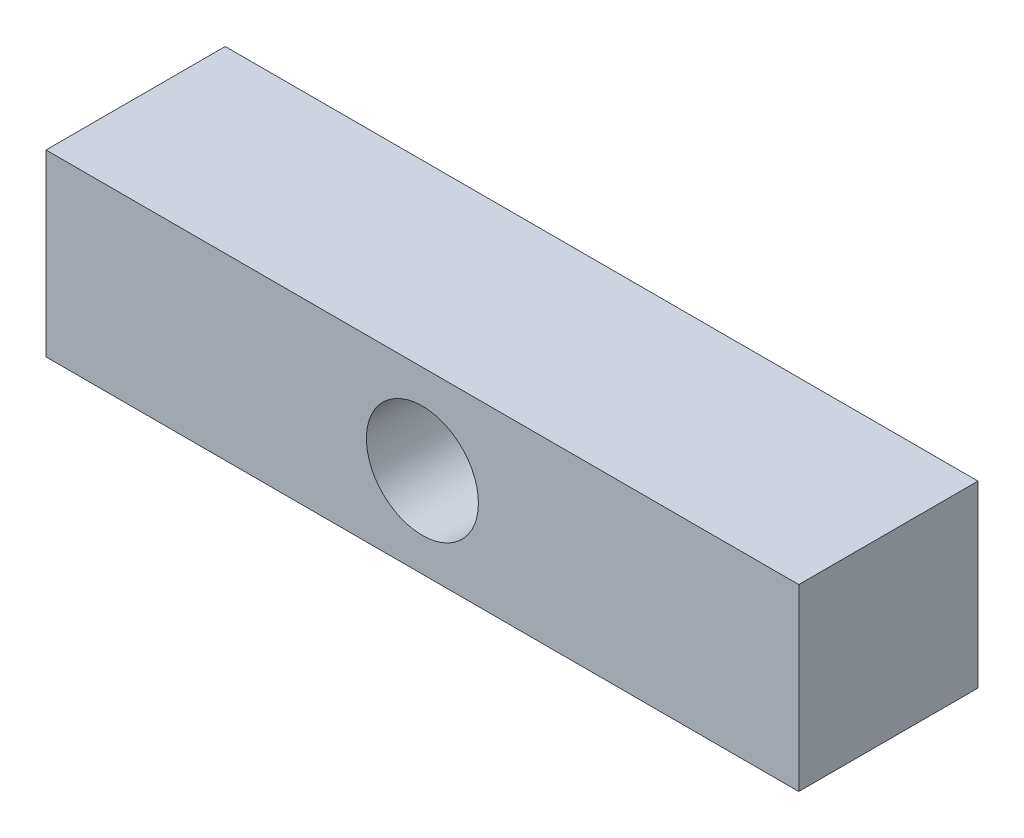
from build123d import *

# Parameters (mm, degrees)
SKETCH1_W                                            = 106.68
SKETCH1_H                                            = 25.4
BOSS_EXTRUDE1_DEPTH                                  = 25.4
SKETCH1_3_R                                          = 8.1915
CUT_EXTRUDE1_DEPTH                                   = 19.05
CBORE_FOR_1_4_BINDING_HEAD_MACHINE_SCREW_D           = 8.0264
CBORE_FOR_1_4_BINDING_HEAD_MACHINE_SCREW_CBORE_D     = 15.875
CBORE_FOR_1_4_BINDING_HEAD_MACHINE_SCREW_CBORE_DEPTH = 19.05


with BuildPart() as part:
    # Sketch1 → Boss-Extrude1 (new body)
    with BuildSketch(Plane.XY):
        Rectangle(SKETCH1_W, SKETCH1_H)
    extrude(amount=BOSS_EXTRUDE1_DEPTH)

    # Sketch1<3> → Cut-Extrude1 (cut)
    with BuildSketch(Plane.XY):
        with Locations(Location((-38.1, 0, 0), (0, 0, 180))):
            Circle(SKETCH1_3_R)
        with Locations(Location((38.1, 0, 0), (0, 0, 180))):
            Circle(SKETCH1_3_R)
    extrude(amount=CUT_EXTRUDE1_DEPTH, mode=Mode.SUBTRACT)

    # CBORE for 1/4 Binding Head Machine Screw1 (through all)
    with Locations(Plane.XY.offset(25.4)):
        with Locations((0, 0)):
            CounterBoreHole(CBORE_FOR_1_4_BINDING_HEAD_MACHINE_SCREW_D / 2, CBORE_FOR_1_4_BINDING_HEAD_MACHINE_SCREW_CBORE_D / 2, CBORE_FOR_1_4_BINDING_HEAD_MACHINE_SCREW_CBORE_DEPTH)


solid = part.part
